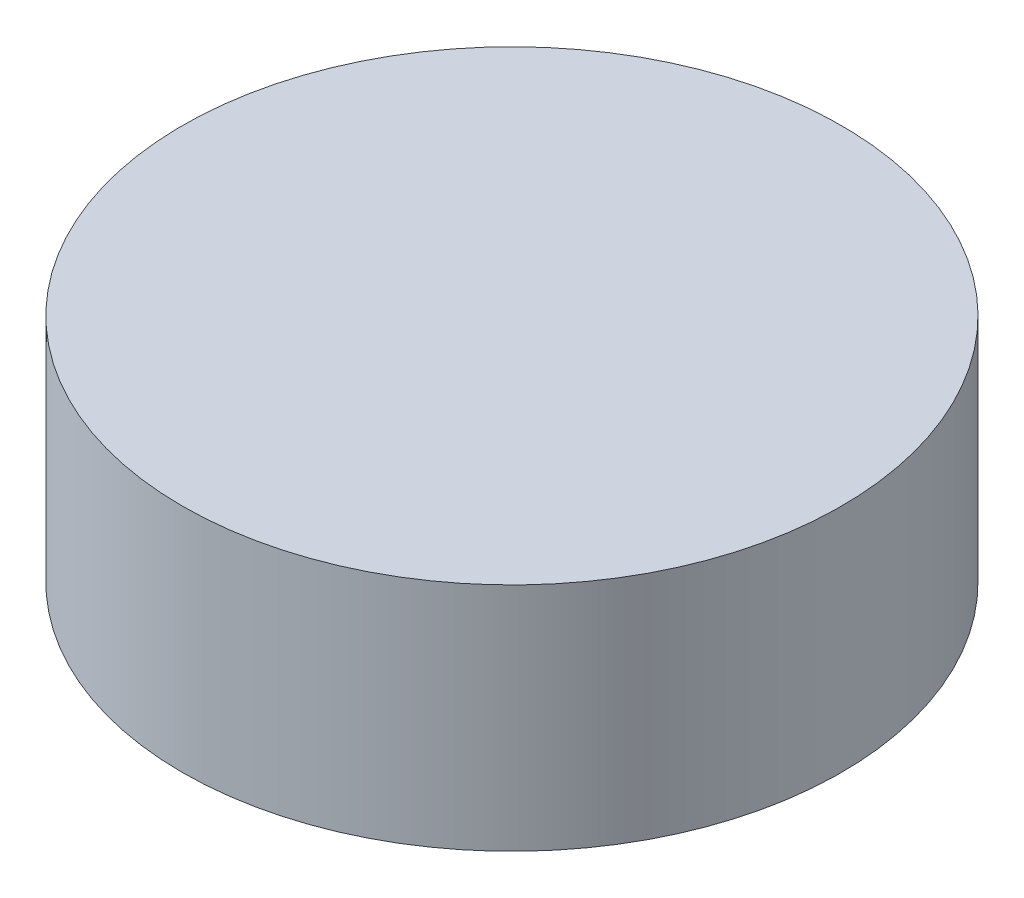
from build123d import *

# Parameters (mm, degrees)
SKETCH1_R           = 3.96875
BOSS_EXTRUDE1_DEPTH = 2.778125


with BuildPart() as part:
    # Sketch1 → Boss-Extrude1 (new body)
    with BuildSketch(Plane(origin=(0, 0, 0), x_dir=(1, 0, 0), z_dir=(0, 1, 0))):
        with Locations(Location((0, 0, 0), (0, 0, 270))):
            Circle(SKETCH1_R)
    extrude(amount=BOSS_EXTRUDE1_DEPTH)


solid = part.part
